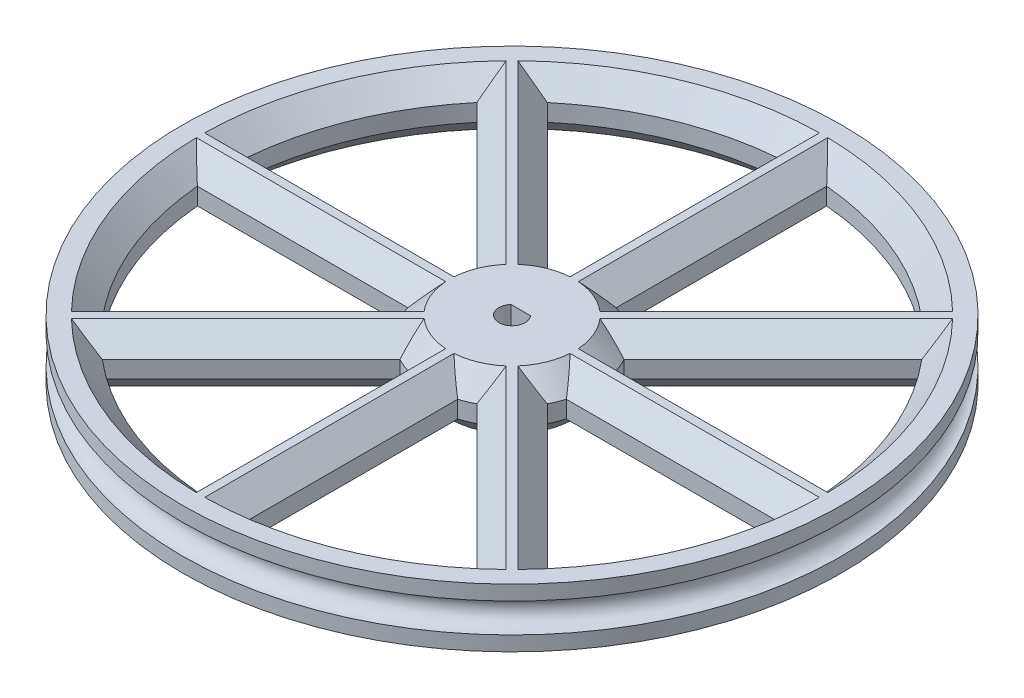
from build123d import *

# Parameters (mm, degrees)
SKETCH1_R           = 39.6621
BOSS_EXTRUDE2_DEPTH = 7.06
SKETCH5_R           = 1.7653
SKETCH7_R           = 1.575
CUT_EXTRUDE1_DEPTH  = 7.06
BOSS_EXTRUDE4_DEPTH = 7.06
CUT_EXTRUDE2_DEPTH  = 7.06
CHAMFER9_SIZE       = 2.5
CHAMFER10_SIZE      = 2.5
CHAMFER11_SIZE      = 2.5
CHAMFER12_SIZE      = 2.5


with BuildPart() as part:
    # Sketch1 → Boss-Extrude2 (new body)
    with BuildSketch(Plane(origin=(0, 0, 0), x_dir=(1, 0, 0), z_dir=(0, 1, 0))):
        with Locations(Location((0, 0, 0), (0, 0, 270))):
            Circle(SKETCH1_R)
    extrude(amount=BOSS_EXTRUDE2_DEPTH)

    # Sketch5 → Cut-Revolve1 (revolve, cut)
    with BuildSketch(Plane(origin=(0, 0, 0), x_dir=(0, 0, -1), z_dir=(1, 0, 0)), mode=Mode.PRIVATE) as cut_revolve1_sk:
        with Locations((39.6621, 3.53)):
            Circle(SKETCH5_R)
    revolve(cut_revolve1_sk.sketch.rotate(Axis((0, 3.53, 0), (0, 1, 0)), 180), axis=Axis((0, 3.53, 0), (0, 1, 0)), mode=Mode.SUBTRACT)

    # Sketch7 → Cut-Extrude1 (cut)
    with BuildSketch(Plane.XZ):
        with Locations(Location((0, 0, 0), (0, 0, 270))):
            Circle(SKETCH7_R)
    extrude(amount=-CUT_EXTRUDE1_DEPTH, mode=Mode.SUBTRACT)

    # Sketch8 → Boss-Extrude4 (add)
    with BuildSketch(Plane.XZ):
        with BuildLine():
            Line((1.173935688, -1.05), (-1.173935688, -1.05))
            ThreePointArc((-1.173935688, -1.05), (0, -1.575), (1.173935688, -1.05))
        make_face()
    extrude(amount=-BOSS_EXTRUDE4_DEPTH)

    # Sketch9 → Cut-Extrude2 (cut)
    with BuildSketch(Plane(origin=(0, 7.06, 0), x_dir=(1, 0, 0), z_dir=(0, 1, 0))):
        with BuildLine():
            Line((-26.778976355, 22.536335668), (-8.866689125, 4.624048438))
            ThreePointArc((-8.866689125, 4.624048438), (-9.238795325, 3.826834324), (-9.539392014, 3))
            Line((-9.539392014, 3), (-34.871191548, 3))
            ThreePointArc((-34.871191548, 3), (-32.335783638, 13.393920133), (-26.778976355, 22.536335668))
        make_face()
        with BuildLine():
            Line((-34.871191548, -3), (-9.539392014, -3))
            ThreePointArc((-9.539392014, -3), (-9.238795325, -3.826834324), (-8.866689125, -4.624048438))
            Line((-8.866689125, -4.624048438), (-26.778976355, -22.536335668))
            ThreePointArc((-26.778976355, -22.536335668), (-32.335783638, -13.393920133), (-34.871191548, -3))
        make_face()
        with BuildLine():
            Line((-22.536335668, -26.778976355), (-4.624048438, -8.866689125))
            ThreePointArc((-4.624048438, -8.866689125), (-3.826834324, -9.238795325), (-3, -9.539392014))
            Line((-3, -9.539392014), (-3, -34.871191548))
            ThreePointArc((-3, -34.871191548), (-13.393920133, -32.335783638), (-22.536335668, -26.778976355))
        make_face()
        with BuildLine():
            Line((3, -9.539392014), (3, -34.871191548))
            ThreePointArc((3, -34.871191548), (13.393920133, -32.335783638), (22.536335668, -26.778976355))
            Line((22.536335668, -26.778976355), (4.624048438, -8.866689125))
            ThreePointArc((4.624048438, -8.866689125), (3.826834324, -9.238795325), (3, -9.539392014))
        make_face()
        with BuildLine():
            Line((8.866689125, -4.624048438), (26.778976355, -22.536335668))
            ThreePointArc((26.778976355, -22.536335668), (32.335783638, -13.393920133), (34.871191548, -3))
            Line((34.871191548, -3), (9.539392014, -3))
            ThreePointArc((9.539392014, -3), (9.238795325, -3.826834324), (8.866689125, -4.624048438))
        make_face()
        with BuildLine():
            Line((9.539392014, 3), (34.871191548, 3))
            ThreePointArc((34.871191548, 3), (32.335783638, 13.393920133), (26.778976355, 22.536335668))
            Line((26.778976355, 22.536335668), (8.866689125, 4.624048438))
            ThreePointArc((8.866689125, 4.624048438), (9.238795325, 3.826834324), (9.539392014, 3))
        make_face()
        with BuildLine():
            Line((3, 34.871191548), (3, 9.539392014))
            ThreePointArc((3, 9.539392014), (3.826834324, 9.238795325), (4.624048438, 8.866689125))
            Line((4.624048438, 8.866689125), (22.536335668, 26.778976355))
            ThreePointArc((22.536335668, 26.778976355), (13.393920133, 32.335783638), (3, 34.871191548))
        make_face()
        with BuildLine():
            Line((-22.536335668, 26.778976355), (-4.624048438, 8.866689125))
            ThreePointArc((-4.624048438, 8.866689125), (-3.826834324, 9.238795325), (-3, 9.539392014))
            Line((-3, 9.539392014), (-3, 34.871191548))
            ThreePointArc((-3, 34.871191548), (-13.393920133, 32.335783638), (-22.536335668, 26.778976355))
        make_face()
    extrude(amount=-CUT_EXTRUDE2_DEPTH, mode=Mode.SUBTRACT)

    # Chamfer9
    chamfer9_edges = [part.edges().sort_by_distance(p)[0] for p in [
        (-13.580192053, 7.06, -17.82283274),
        (-17.82283274, 7.06, -13.580192053),
    ]]
    chamfer(chamfer9_edges, length=CHAMFER9_SIZE)

    # Chamfer10
    chamfer10_edges = [part.edges().sort_by_distance(p)[0] for p in [
        (-13.580192053, 0, -17.82283274),
        (-17.82283274, 0, -13.580192053),
    ]]
    chamfer(chamfer10_edges, length=CHAMFER10_SIZE)

    # Chamfer11
    chamfer11_edges = [part.edges().sort_by_distance(p)[0] for p in [
        (-9.238795325, 7.06, 3.826834324),
        (-22.205291781, 7.06, 3),
        (-32.335783638, 7.06, 13.393920133),
        (-17.82283274, 7.06, 13.580192053),
        (-3.826834324, 7.06, 9.238795325),
        (-13.580192053, 7.06, 17.82283274),
        (-13.393920133, 7.06, 32.335783638),
        (-3, 7.06, 22.205291781),
        (13.393920133, 7.06, 32.335783638),
        (3, 7.06, 22.205291781),
        (3.826834324, 7.06, 9.238795325),
        (13.580192053, 7.06, 17.82283274),
        (9.238795325, 7.06, 3.826834324),
        (17.82283274, 7.06, 13.580192053),
        (32.335783638, 7.06, 13.393920133),
        (22.205291781, 7.06, 3),
        (32.335783638, 7.06, -13.393920133),
        (22.205291781, 7.06, -3),
        (17.82283274, 7.06, -13.580192053),
        (9.238795325, 7.06, -3.826834324),
        (3.826834324, 7.06, -9.238795325),
        (13.580192053, 7.06, -17.82283274),
        (13.393920133, 7.06, -32.335783638),
        (3, 7.06, -22.205291781),
        (-14.541651461, 7.06, -31.836148837),
        (-3, 7.06, -22.205291781),
        (-4.969104941, 7.06, -8.678017981),
        (-8.678017981, 7.06, -4.969104941),
        (-22.205291781, 7.06, -3),
        (-31.836148837, 7.06, -14.541651461),
    ]]
    chamfer(chamfer11_edges, length=CHAMFER11_SIZE)

    # Chamfer12
    chamfer12_edges = [part.edges().sort_by_distance(p)[0] for p in [
        (3.826834324, 0, -9.238795325),
        (13.580192053, 0, -17.82283274),
        (13.393920133, 0, -32.335783638),
        (3, 0, -22.205291781),
        (-14.541651461, 0, -31.836148837),
        (-4.969104941, 0, -8.678017981),
        (-3, 0, -22.205291781),
        (-8.678017981, 0, -4.969104941),
        (-31.836148837, 0, -14.541651461),
        (-22.205291781, 0, -3),
        (-17.82283274, 0, 13.580192053),
        (-9.238795325, 0, 3.826834324),
        (-32.335783638, 0, 13.393920133),
        (-22.205291781, 0, 3),
        (-3.826834324, 0, 9.238795325),
        (-13.580192053, 0, 17.82283274),
        (-13.393920133, 0, 32.335783638),
        (-3, 0, 22.205291781),
        (3.826834324, 0, 9.238795325),
        (3, 0, 22.205291781),
        (13.393920133, 0, 32.335783638),
        (13.580192053, 0, 17.82283274),
        (9.238795325, 0, 3.826834324),
        (17.82283274, 0, 13.580192053),
        (32.335783638, 0, 13.393920133),
        (22.205291781, 0, 3),
        (9.238795325, 0, -3.826834324),
        (17.82283274, 0, -13.580192053),
        (22.205291781, 0, -3),
        (32.335783638, 0, -13.393920133),
    ]]
    chamfer(chamfer12_edges, length=CHAMFER12_SIZE)


solid = part.part
